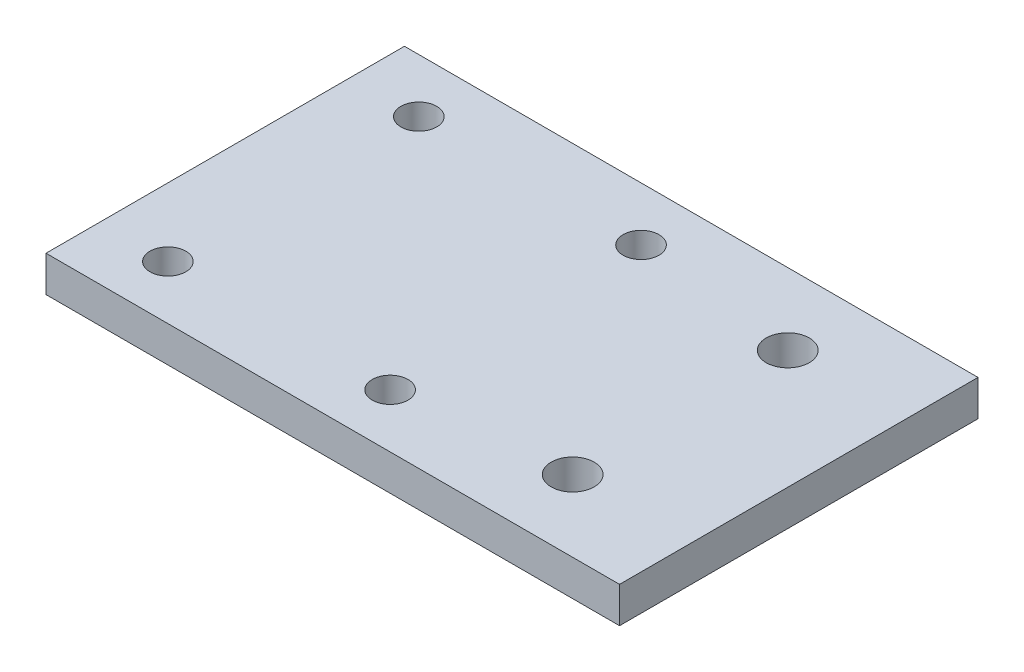
from build123d import *

# Parameters (mm, degrees)
SKETCH2_W           = 80
SKETCH2_H           = 50
SKETCH2_R           = 3
BOSS_EXTRUDE1_DEPTH = 5
SKETCH3_R           = 2.5
CUT_EXTRUDE1_DEPTH  = 10


with BuildPart() as part:
    # Sketch2 → Boss-Extrude1 (new body)
    with BuildSketch(Plane(origin=(0, 0, 0), x_dir=(1, 0, 0), z_dir=(0, 1, 0))):
        with Locations((40, 25)):
            Rectangle(SKETCH2_W, SKETCH2_H)
        with Locations(Location((63.461538462, 10, 0), (0, 0, 270))):
            Circle(SKETCH2_R, mode=Mode.SUBTRACT)
        with Locations(Location((63.461538462, 40, 0), (0, 0, 270))):
            Circle(SKETCH2_R, mode=Mode.SUBTRACT)
    extrude(amount=BOSS_EXTRUDE1_DEPTH)

    # Sketch3 → Cut-Extrude1 (cut)
    with BuildSketch(Plane(origin=(0, 5, 0), x_dir=(1, 0, 0), z_dir=(0, 1, 0))):
        with Locations(Location((40.5, 7.5, 0), (0, 0, 270))):
            Circle(SKETCH3_R)
        with Locations(Location((9.5, 7.5, 0), (0, 0, 270))):
            Circle(SKETCH3_R)
        with Locations(Location((40.5, 42.5, 0), (0, 0, 270))):
            Circle(SKETCH3_R)
        with Locations(Location((9.5, 42.5, 0), (0, 0, 270))):
            Circle(SKETCH3_R)
    extrude(amount=-CUT_EXTRUDE1_DEPTH, mode=Mode.SUBTRACT)


solid = part.part
